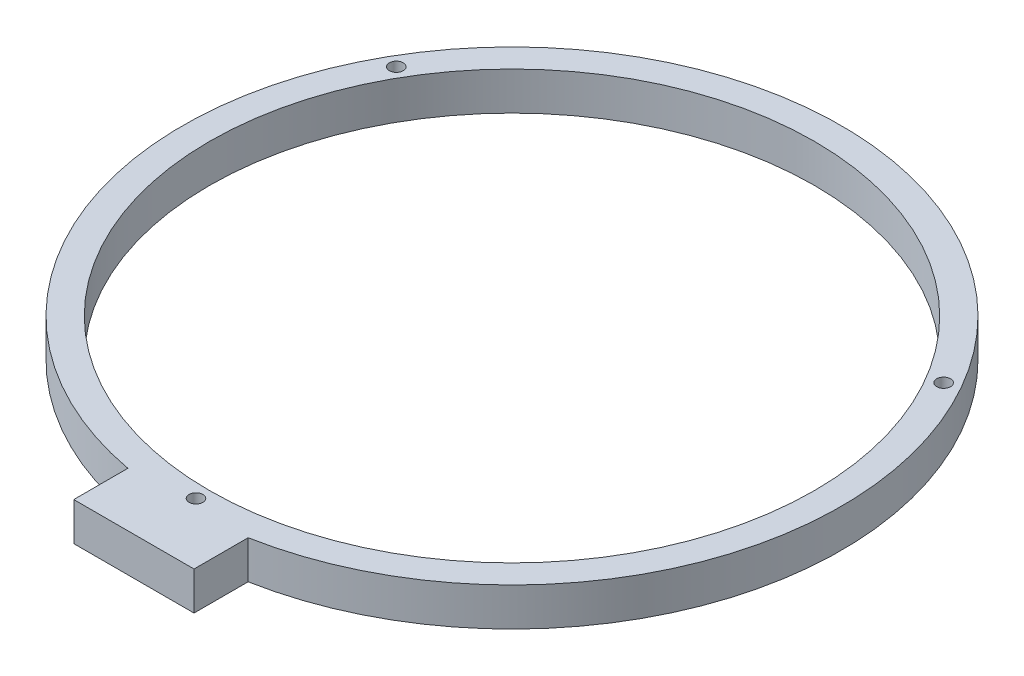
from build123d import *

# Parameters (mm, degrees)
SKETCH1_R           = 50.3
BOSS_EXTRUDE1_DEPTH = 6.35
CUT_EXTRUDE1_REACH  = 85.65
SKETCH2_R           = 1.15
CIRPATTERN1_COUNT   = 3


with BuildPart() as part:
    # Sketch1 → Boss-Extrude1 (new body)
    with BuildSketch(Plane(origin=(0, 0, 0), x_dir=(1, 0, 0), z_dir=(0, 1, 0))):
        with BuildLine():
            Line((-10, -53.87986637), (-10, -62.87986637))
            Line((-10, -62.87986637), (10, -62.87986637))
            Line((10, -62.87986637), (10, -53.87986637))
            ThreePointArc((10, -53.87986637), (0, 54.8), (-10, -53.87986637))
        make_face()
        with Locations(Location((0, 0, 0), (0, 0, 270))):
            Circle(SKETCH1_R, mode=Mode.SUBTRACT)
    extrude(amount=BOSS_EXTRUDE1_DEPTH)

    # Sketch2 → Cut-Extrude1 (cut, up to next)
    with BuildSketch(Plane(origin=(0, 6.35, 0), x_dir=(1, 0, 0), z_dir=(0, 1, 0)), mode=Mode.PRIVATE) as cut_extrude1_sk1:
        with Locations(Location((0, -52.55, 0), (0, 0, 270))):
            Circle(SKETCH2_R)
    cut_extrude1_tool1 = extrude(cut_extrude1_sk1.sketch, amount=-CUT_EXTRUDE1_REACH, mode=Mode.PRIVATE) & part.part
    cut_extrude1 = cut_extrude1_tool1.solids().sort_by_distance((0, 6.35, 52.55))[0]
    add(cut_extrude1, mode=Mode.SUBTRACT)

    # CirPattern1: Cut-Extrude1 ×3 about axis
    cirpattern1_axis = Axis((0, 0, 0), (0, 1, 0))
    for i in range(1, CIRPATTERN1_COUNT):
        add(cut_extrude1.rotate(cirpattern1_axis, i * 360 / CIRPATTERN1_COUNT), mode=Mode.SUBTRACT)


solid = part.part
